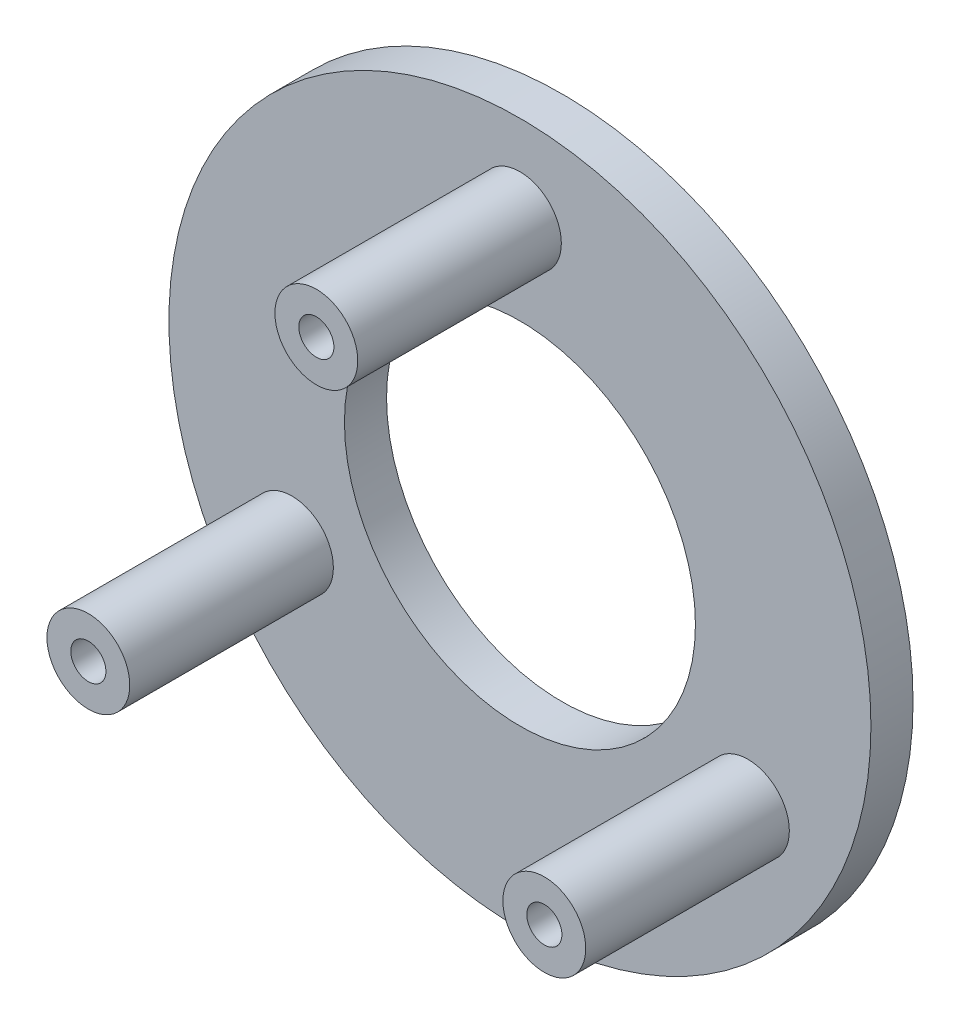
from build123d import *

# Parameters (mm, degrees)
SKETCH1_R           = 25
SKETCH1_R_2         = 12.5
SKETCH1_R_3         = 2.95
BOSS_EXTRUDE1_DEPTH = 3
SKETCH4_R           = 2.95
BOSS_EXTRUDE3_DEPTH = 17.5
SKETCH5_R           = 1.25
CUT_EXTRUDE2_DEPTH  = 8


with BuildPart() as part:
    # Sketch1 → Boss-Extrude1 (new body)
    with BuildSketch(Plane.XY):
        Circle(SKETCH1_R)
        Circle(SKETCH1_R_2, mode=Mode.SUBTRACT)
        with Locations((0, 18.75)):
            Circle(SKETCH1_R_3, mode=Mode.SUBTRACT)
        with Locations((16.237976321, -9.375)):
            Circle(SKETCH1_R_3, mode=Mode.SUBTRACT)
        with Locations((-16.237976321, -9.375)):
            Circle(SKETCH1_R_3, mode=Mode.SUBTRACT)
    extrude(amount=BOSS_EXTRUDE1_DEPTH)

    # Sketch4 → Boss-Extrude3 (add)
    with BuildSketch(Plane(origin=(0, 0, 0), x_dir=(-1, 0, 0), z_dir=(0, 0, -1))):
        with Locations((16.237976321, -9.375)):
            Circle(SKETCH4_R)
        with Locations((0, 18.75)):
            Circle(SKETCH4_R)
        with Locations((-16.237976321, -9.375)):
            Circle(SKETCH4_R)
    extrude(amount=-BOSS_EXTRUDE3_DEPTH)

    # Sketch5 → Cut-Extrude2 (cut)
    with BuildSketch(Plane.XY.offset(17.5)):
        with Locations((16.237976321, -9.375)):
            Circle(SKETCH5_R)
        with Locations((-16.237976321, -9.375)):
            Circle(SKETCH5_R)
        with Locations((0, 18.75)):
            Circle(SKETCH5_R)
    extrude(amount=-CUT_EXTRUDE2_DEPTH, mode=Mode.SUBTRACT)


solid = part.part
